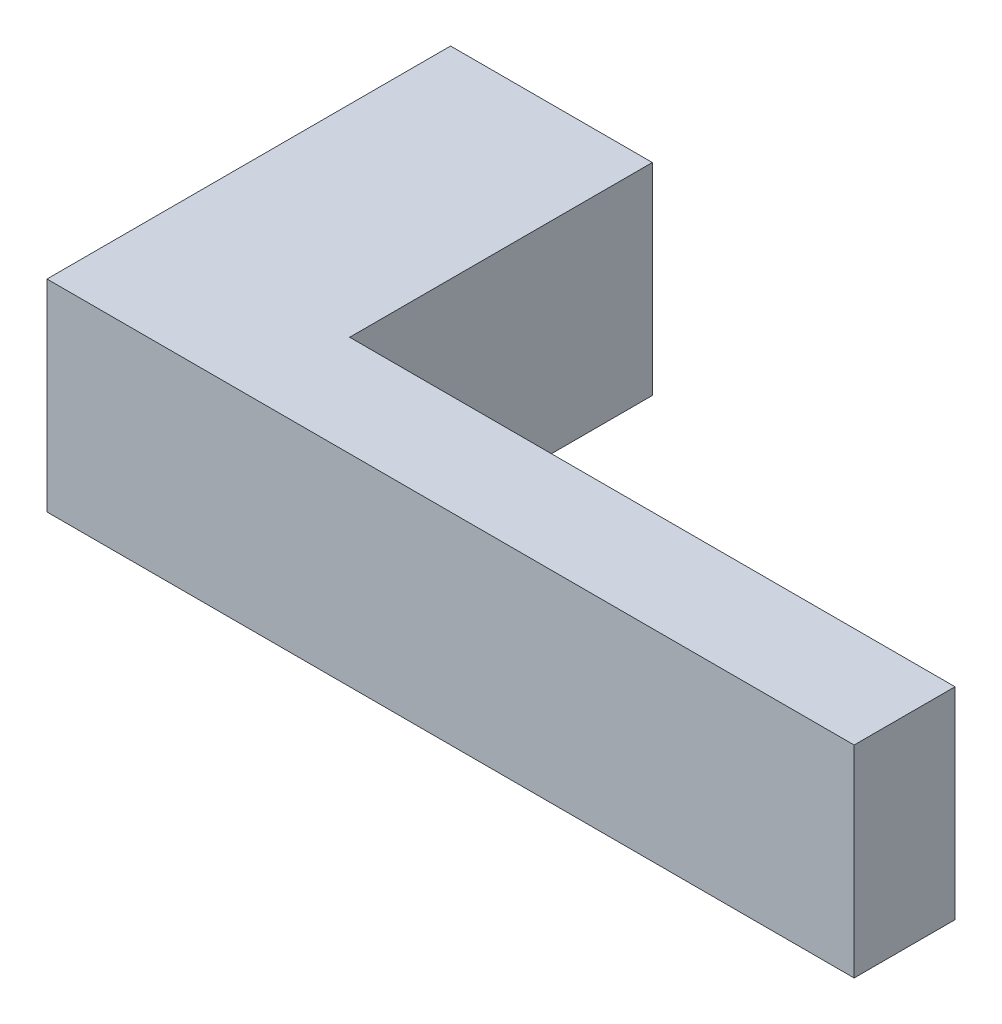
from build123d import *

# Parameters (mm, degrees)
BOSS_EXTRUDE1_DEPTH = 20


with BuildPart() as part:
    # Sketch2 → Boss-Extrude1 (new body)
    with BuildSketch(Plane(origin=(0, 0, 0), x_dir=(1, 0, 0), z_dir=(0, 1, 0))):
        Polygon((0, -40), (0, 0), (20, 0), (20, -30), (80, -30), (80, -40), align=None)
    extrude(amount=BOSS_EXTRUDE1_DEPTH)


solid = part.part
